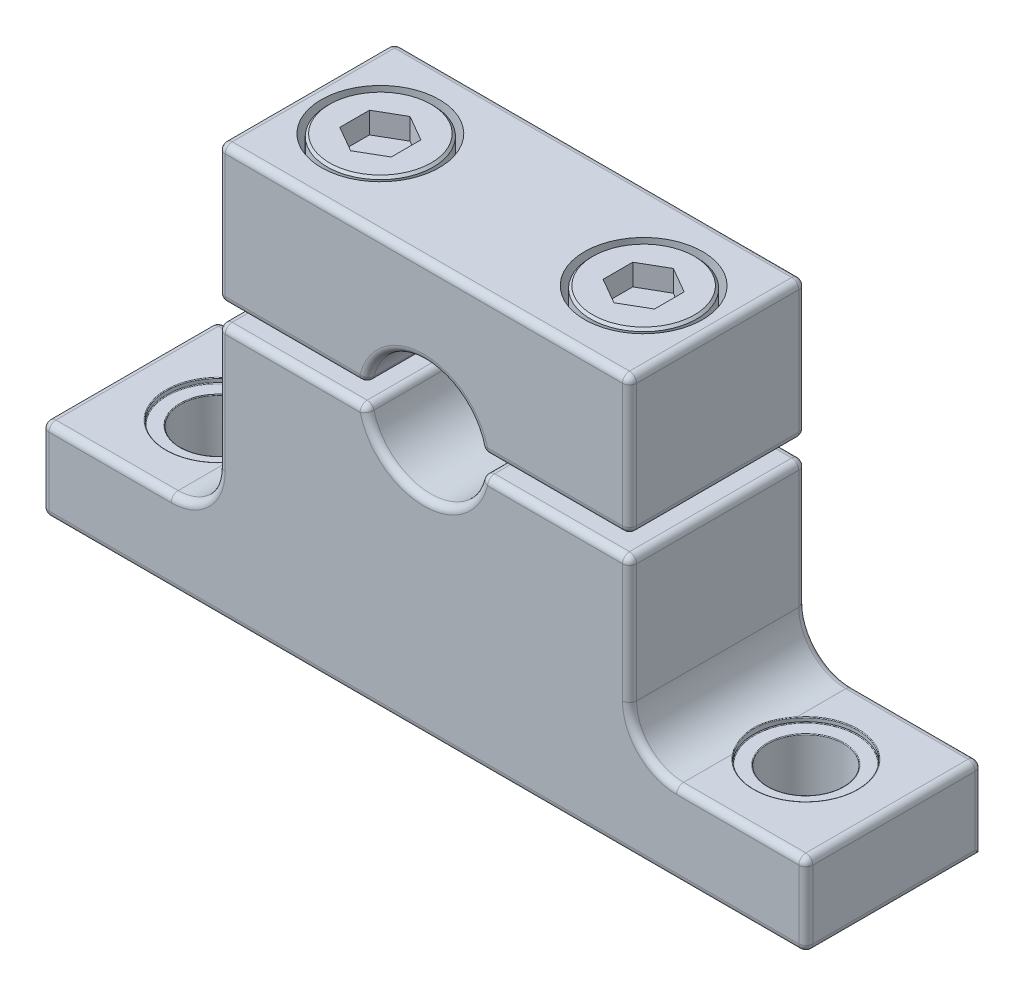
from build123d import *

# Parameters (mm, degrees)
BOSS_EXTRUDE1_DEPTH   = 9.525
BOSS_EXTRUDE1_2_DEPTH = 9.525
SKETCH4_R             = 2.032
CUT_EXTRUDE1_DEPTH    = 32.789662726
SKETCH8_R             = 2.794
CUT_EXTRUDE3_DEPTH    = 9.5885
SKETCH10_R            = 2.0066
CUT_EXTRUDE4_DEPTH    = 32.789662756
SKETCH12_R            = 3.1877
CUT_EXTRUDE5_DEPTH    = 3.8862
CHAMFER1_SIZE         = 0.127
CUT_EXTRUDE6_DEPTH    = 1.156716
FILLET1_R             = 0.381
FILLET2_R             = 0.381
FILLET3_R             = 0.0381


with BuildPart() as part:
    # Sketch3 → Boss-Extrude1 (new body)
    with BuildSketch(Plane.XY):
        with BuildLine():
            Line((-11.1125, 22.225), (11.1125, 22.225))
            Line((11.1125, 22.225), (11.1125, 14.7955))
            Line((11.1125, 14.7955), (3.134096521, 14.7955))
            ThreePointArc((3.134096521, 14.7955), (0, 17.4625), (-3.134096521, 14.7955))
            Line((-3.134096521, 14.7955), (-11.1125, 14.7955))
            Line((-11.1125, 14.7955), (-11.1125, 22.225))
        make_face()
    extrude(amount=-BOSS_EXTRUDE1_DEPTH)


with BuildPart() as body_2:
    # Sketch3 → Boss-Extrude1 2 (new body)
    with BuildSketch(Plane.XY):
        with BuildLine():
            Line((-11.1125, 13.7795), (-11.1125, 6.985))
            ThreePointArc((-11.1125, 6.985), (-11.856448776, 5.188948776), (-13.6525, 4.445))
            Line((-13.6525, 4.445), (-20.6375, 4.445))
            Line((-20.6375, 4.445), (-20.6375, 0))
            Line((-20.6375, 0), (20.6375, 0))
            Line((20.6375, 0), (20.6375, 4.445))
            Line((20.6375, 4.445), (13.6525, 4.445))
            ThreePointArc((13.6525, 4.445), (11.856448776, 5.188948776), (11.1125, 6.985))
            Line((11.1125, 6.985), (11.1125, 13.7795))
            Line((11.1125, 13.7795), (3.134096521, 13.7795))
            ThreePointArc((3.134096521, 13.7795), (0, 11.1125), (-3.134096521, 13.7795))
            Line((-3.134096521, 13.7795), (-11.1125, 13.7795))
        make_face()
    extrude(amount=-BOSS_EXTRUDE1_2_DEPTH)

    # Sketch4 → Cut-Extrude1 (cut, through all)
    with BuildSketch(Plane.XZ):
        with Locations((-15.875, -4.7625)):
            Circle(SKETCH4_R)
        with Locations(Location((15.875, -4.7625, 0), (0, 0, 90))):
            Circle(SKETCH4_R)
    extrude(amount=-CUT_EXTRUDE1_DEPTH, mode=Mode.SUBTRACT)

    # Sketch8 → Cut-Extrude3 (cut)
    with BuildSketch(Plane(origin=(0, 13.7795, 0), x_dir=(1, 0, 0), z_dir=(0, 1, 0))):
        with Locations(Location((-15.875, 4.7625, 0), (0, 0, 180))):
            Circle(SKETCH8_R)
        with Locations(Location((15.875, 4.7625, 0), (0, 0, 142.698209709))):
            Circle(SKETCH8_R)
    extrude(amount=-CUT_EXTRUDE3_DEPTH, mode=Mode.SUBTRACT)


with BuildPart() as cut_extrude4_tool:
    # Sketch10 → Cut-Extrude4 (new, through all)
    with BuildSketch(Plane(origin=(0, 22.225, 0), x_dir=(1, 0, 0), z_dir=(0, 1, 0))):
        with Locations(Location((7.112, 4.7625, 0), (0, 0, 180))):
            Circle(SKETCH10_R)
        with Locations(Location((-7.112, 4.7625, 0), (0, 0, 180))):
            Circle(SKETCH10_R)
    extrude(amount=-CUT_EXTRUDE4_DEPTH)


with BuildPart() as part_1:
    add(part.part)

    # Cut-Extrude4: cut by cut_extrude4_tool
    add(cut_extrude4_tool.part, mode=Mode.SUBTRACT)

    # Sketch12 → Cut-Extrude5 (cut)
    with BuildSketch(Plane(origin=(0, 22.225, 0), x_dir=(1, 0, 0), z_dir=(0, 1, 0))):
        with Locations(Location((7.112, 4.7625, 0), (0, 0, 180))):
            Circle(SKETCH12_R)
        with Locations(Location((-7.112, 4.7625, 0), (0, 0, 180))):
            Circle(SKETCH12_R)
    extrude(amount=-CUT_EXTRUDE5_DEPTH, mode=Mode.SUBTRACT)

    # Fillet1
    fillet1_edges = [part_1.edges().sort_by_distance(p)[0] for p in [
        (0, 17.4625, -9.525),
        (-11.1125, 22.225, -4.7625),
        (11.1125, 22.225, -4.7625),
        (11.1125, 14.7955, -4.7625),
        (3.134096521, 14.7955, -4.7625),
        (-3.134096521, 14.7955, -4.7625),
        (-11.1125, 14.7955, -4.7625),
        (7.12329826, 14.7955, -9.525),
        (11.1125, 18.51025, -9.525),
        (0, 22.225, -9.525),
        (-11.1125, 18.51025, -9.525),
        (0, 22.225, 0),
        (11.1125, 18.51025, 0),
        (7.12329826, 14.7955, 0),
        (-7.12329826, 14.7955, -9.525),
        (0, 17.4625, 0),
        (-7.12329826, 14.7955, 0),
        (-11.1125, 18.51025, 0),
    ]]
    fillet(fillet1_edges, radius=FILLET1_R)


with BuildPart() as body_2_1:
    add(body_2.part)

    # Cut-Extrude4: cut by cut_extrude4_tool
    add(cut_extrude4_tool.part, mode=Mode.SUBTRACT)

    # Fillet2
    fillet2_edges = [body_2_1.edges().sort_by_distance(p)[0] for p in [
        (-11.856448776, 5.188948776, -9.525),
        (0, 11.1125, 0),
        (7.12329826, 13.7795, 0),
        (11.1125, 10.38225, 0),
        (11.856448776, 5.188948776, 0),
        (17.145, 4.445, 0),
        (20.6375, 2.2225, 0),
        (-17.145, 4.445, -9.525),
        (0, 0, 0),
        (-20.6375, 2.2225, 0),
        (-17.145, 4.445, 0),
        (-11.856448776, 5.188948776, 0),
        (-11.1125, 10.38225, 0),
        (-7.12329826, 13.7795, 0),
        (-20.6375, 2.2225, -9.525),
        (-3.134096521, 13.7795, -4.7625),
        (3.134096521, 13.7795, -4.7625),
        (11.1125, 13.7795, -4.7625),
        (20.6375, 4.445, -4.7625),
        (20.6375, 0, -4.7625),
        (-20.6375, 0, -4.7625),
        (-20.6375, 4.445, -4.7625),
        (-11.1125, 13.7795, -4.7625),
        (20.6375, 2.2225, -9.525),
        (17.145, 4.445, -9.525),
        (11.856448776, 5.188948776, -9.525),
        (11.1125, 10.38225, -9.525),
        (7.12329826, 13.7795, -9.525),
        (0, 11.1125, -9.525),
        (-7.12329826, 13.7795, -9.525),
        (-11.1125, 10.38225, -9.525),
    ]]
    fillet(fillet2_edges, radius=FILLET2_R)

    # Fillet3
    fillet3_edges = [body_2_1.edges().sort_by_distance(p)[0] for p in [
        (-13.081, 4.510128741, -4.7625),
        (-16.768524202, 4.445, -7.409772275),
        (-13.081, 4.191, -4.7625),
        (-17.907, 4.191, -4.7625),
        (18.669, 4.445, -4.7625),
        (13.081, 4.510128741, -4.7625),
        (15.875, 4.191, -6.7945),
        (18.0975, 4.191, -3.069298964),
    ]]
    fillet(fillet3_edges, radius=FILLET3_R)


with BuildPart() as body_3:
    # Sketch15 → Revolve1 (revolve)
    with BuildSketch(Plane.XY.offset(-4.7625), mode=Mode.PRIVATE) as revolve1_sk:
        Polygon((-7.112, 8.89), (-7.112, 22.225), (-9.9822, 22.225), (-9.9822, 18.7198), (-8.8646, 18.7198), (-8.8646, 8.89), align=None)
    revolve(revolve1_sk.sketch.rotate(Axis((-7.112, 8.89, -4.7625), (0, 1, 0)), 270), axis=Axis((-7.112, 8.89, -4.7625), (0, 1, 0)))

    # Chamfer1
    chamfer1_edges = [body_3.edges().sort_by_distance(p)[0] for p in [
        (-7.112, 22.225, -1.8923),
    ]]
    chamfer(chamfer1_edges, length=CHAMFER1_SIZE)

    # Sketch16 → Cut-Extrude6 (cut)
    with BuildSketch(Plane(origin=(0, 22.225, 0), x_dir=(1, 0, 0), z_dir=(0, 1, 0))):
        Polygon((-7.112, 6.366451217), (-8.5010625, 5.564475608), (-8.5010625, 3.960524392), (-7.112, 3.158548783), (-5.7229375, 3.960524392), (-5.7229375, 5.564475608), align=None)
    extrude(amount=-CUT_EXTRUDE6_DEPTH, mode=Mode.SUBTRACT)


with BuildPart() as body_4:
    # Mirror1: mirrored copy
    add(body_3.part.mirror(Plane(origin=(0, 0, 0), x_dir=(0, 0, 1), z_dir=(1, 0, 0))))


solid = Compound([part_1.part, body_2_1.part, body_3.part, body_4.part])
